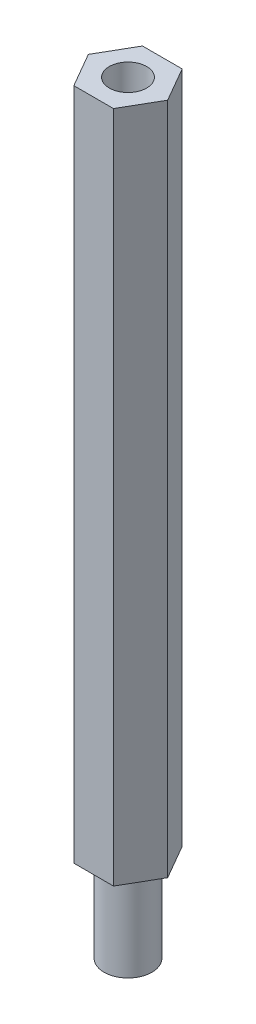
from build123d import *

# Parameters (mm, degrees)
EXTRUDE_1_DEPTH     = 45
SKETCH_6_R          = 1.6
EXTRUDE_2_DEPTH     = 6
SKETCH_7_R          = 1.25
CUT_EXTRUDE_1_DEPTH = 5


with BuildPart() as part:
    # 草图4 → 凸台-拉伸1 (new body)
    with BuildSketch(Plane(origin=(0, 0, 0), x_dir=(1, 0, 0), z_dir=(0, 1, 0))):
        Polygon((1.325, -2.29496732), (2.65, 0), (1.325, 2.29496732), (-1.325, 2.29496732), (-2.65, 0), (-1.325, -2.29496732), align=None)
    extrude(amount=EXTRUDE_1_DEPTH)

    # 草图6 → 凸台-拉伸2 (add)
    with BuildSketch(Plane(origin=(0, 0, 0), x_dir=(-1, 0, 0), z_dir=(0, -1, 0))):
        with Locations(Location((0, 0, 0), (0, 0, 270))):
            Circle(SKETCH_6_R)
    extrude(amount=EXTRUDE_2_DEPTH)

    # 草图7 → 切除-拉伸1 (cut)
    with BuildSketch(Plane(origin=(0, 45, 0), x_dir=(1, 0, 0), z_dir=(0, 1, 0))):
        with Locations(Location((0, 0, 0), (0, 0, 270))):
            Circle(SKETCH_7_R)
    extrude(amount=-CUT_EXTRUDE_1_DEPTH, mode=Mode.SUBTRACT)


solid = part.part
